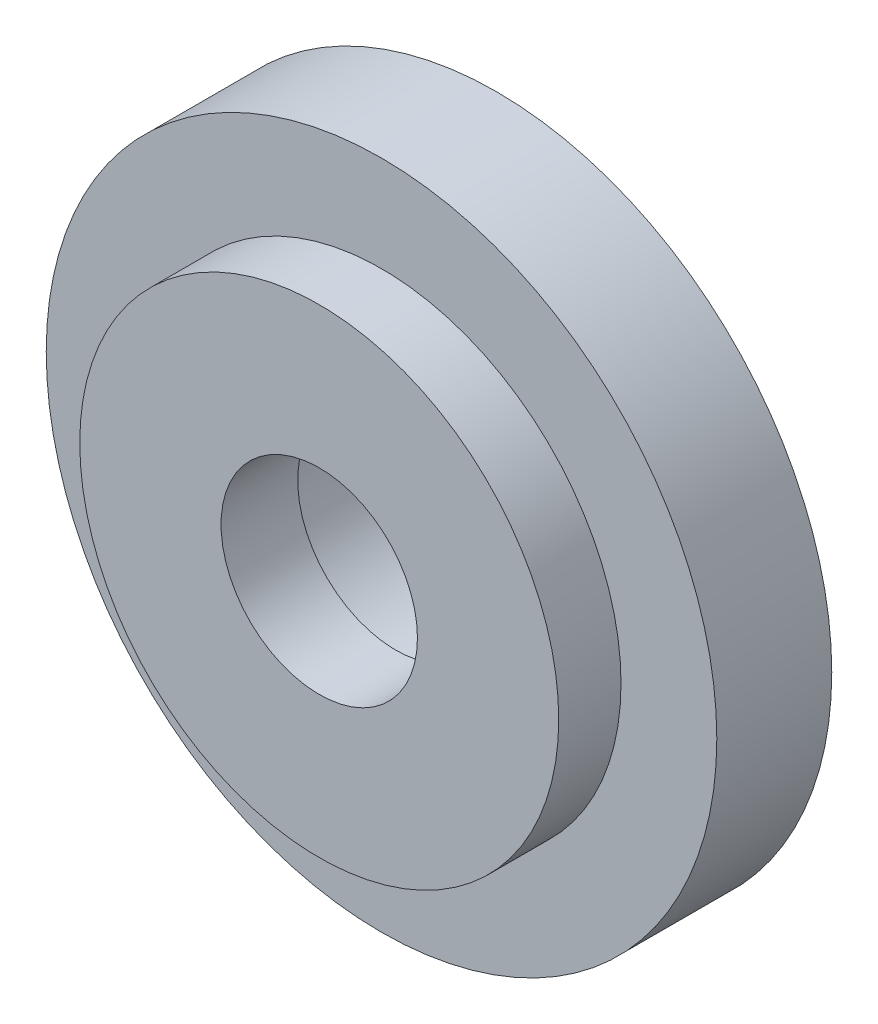
from build123d import *

# Parameters (mm, degrees)
SKETCH1_R           = 12.7
BOSS_EXTRUDE1_DEPTH = 12.7
SKETCH2_R           = 17.78
BOSS_EXTRUDE2_DEPTH = 3.048
SKETCH9_R           = 6.477
CUT_EXTRUDE5_DEPTH  = 2.286
SKETCH10_R          = 6.731
CUT_EXTRUDE6_DEPTH  = 4.064
SKETCH11_R          = 5.207
CUT_EXTRUDE7_DEPTH  = 29.169962726


with BuildPart() as part:
    # Sketch1 → Boss-Extrude1 (new body)
    with BuildSketch(Plane.XY):
        Circle(SKETCH1_R)
    extrude(amount=BOSS_EXTRUDE1_DEPTH)

    # Sketch2 → Boss-Extrude2 (add, symmetric)
    with BuildSketch(Plane.XY.offset(6.35)):
        with Locations(Location((0, 0, 0), (0, 0, 180))):
            Circle(SKETCH2_R)
    extrude(amount=BOSS_EXTRUDE2_DEPTH, both=True)

    # Sketch9 → Cut-Extrude5 (cut, symmetric)
    with BuildSketch(Plane.XY.offset(6.35)):
        Circle(SKETCH9_R)
    extrude(amount=CUT_EXTRUDE5_DEPTH, both=True, mode=Mode.SUBTRACT)

    # Sketch10 → Cut-Extrude6 (cut)
    with BuildSketch(Plane(origin=(0, 0, 0), x_dir=(-1, 0, 0), z_dir=(0, 0, -1))):
        Circle(SKETCH10_R)
    extrude(amount=-CUT_EXTRUDE6_DEPTH, mode=Mode.SUBTRACT)

    # Sketch11 → Cut-Extrude7 (cut, through all)
    with BuildSketch(Plane.XY.offset(12.7)):
        Circle(SKETCH11_R)
    extrude(amount=-CUT_EXTRUDE7_DEPTH, mode=Mode.SUBTRACT)


solid = part.part
